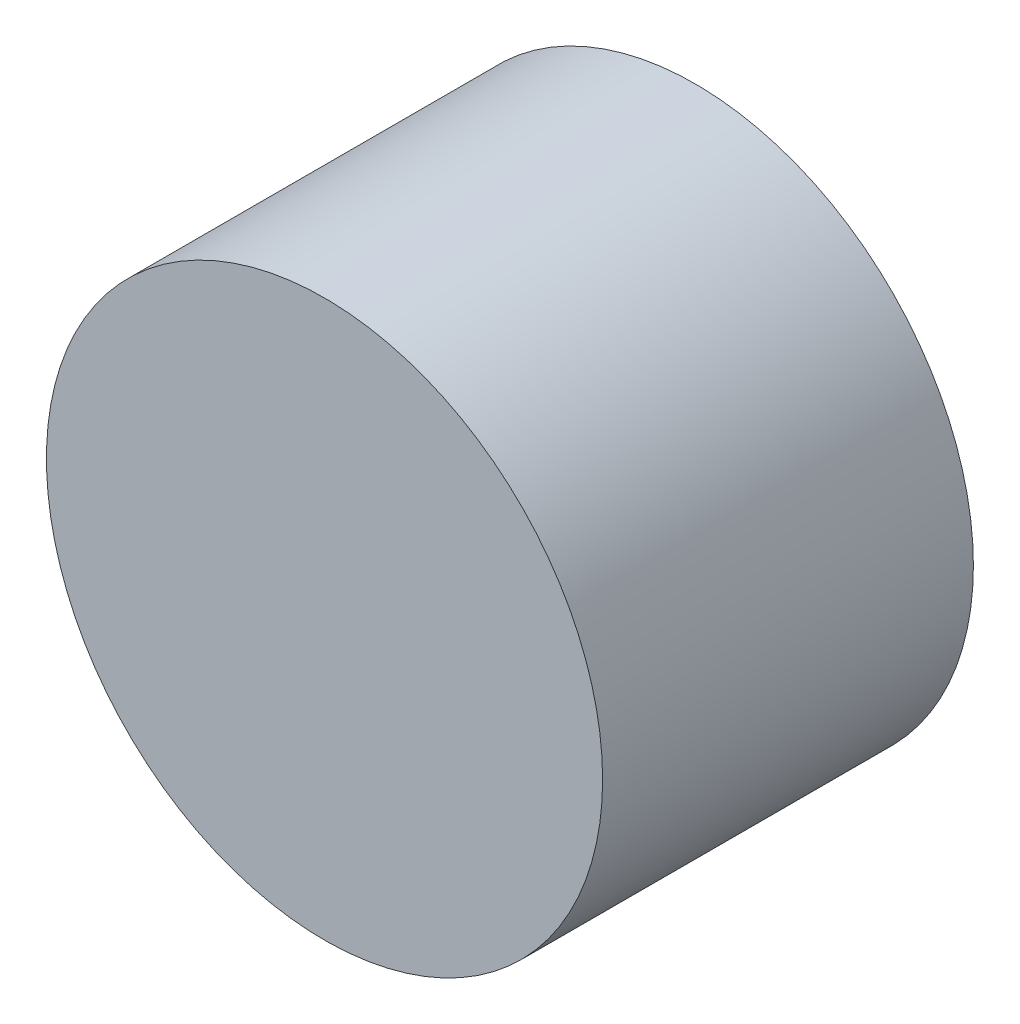
from build123d import *

# Parameters (mm, degrees)
CROQUIS1_R              = 75
SALIENTE_EXTRUIR1_DEPTH = 100
VACIADO1_T              = -10


with BuildPart() as part:
    # Croquis1 → Saliente-Extruir1 (new body)
    with BuildSketch(Plane.XY):
        Circle(CROQUIS1_R)
    extrude(amount=SALIENTE_EXTRUIR1_DEPTH)

    # Vaciado1
    vaciado1_openings = [part.faces().sort_by_distance(p)[0] for p in [
        (0, 0, 0),
    ]]
    offset(amount=VACIADO1_T, openings=vaciado1_openings, kind=Kind.INTERSECTION)


solid = part.part
